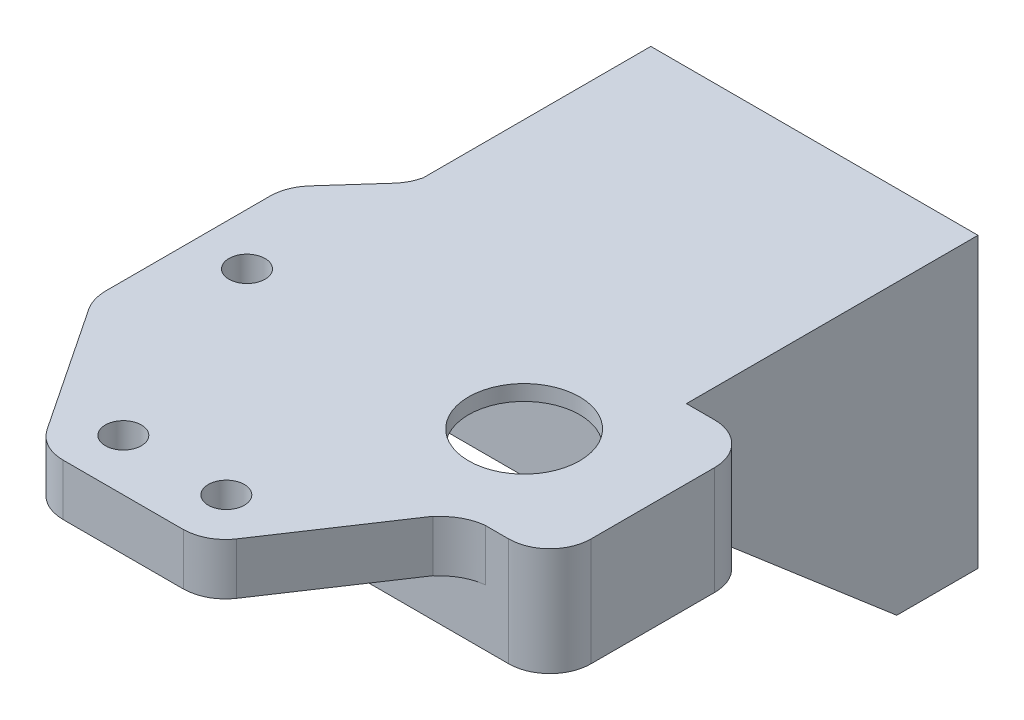
from build123d import *

# Parameters (mm, degrees)
CROQUIS2_W              = 35
CROQUIS2_H              = 20
SALIENTE_EXTRUIR1_DEPTH = 10.5
CROQUIS3_W              = 23
CROQUIS3_H              = 13
CORTAR_EXTRUIR1_DEPTH   = 9
CROQUIS4_R              = 1
CORTAR_EXTRUIR2_DEPTH   = 4
CROQUIS5_R              = 5.386
CORTAR_EXTRUIR3_DEPTH   = 4
REDONDEO1_R             = 4
SALIENTE_EXTRUIR2_DEPTH = 5
CROQUIS13_W             = 23
CROQUIS13_H             = 13
CORTAR_EXTRUIR4_DEPTH   = 9
CORTAR_EXTRUIR5_REACH   = 39.771
CROQUIS14_R             = 5.386
CORTAR_EXTRUIR6_REACH   = 40.156
CROQUIS15_R             = 1.75
CROQUIS17_W             = 28.298517207
CROQUIS17_H             = 28
SALIENTE_EXTRUIR5_DEPTH = 38.5
CROQUIS18_W             = 6.74314
CROQUIS18_H             = 28.298517207
CORTAR_EXTRUIR7_DEPTH   = 38.5
CROQUIS19_W             = 25.75686
CROQUIS19_H             = 20
CORTAR_EXTRUIR8_DEPTH   = 20.5
CORTAR_EXTRUIR9_DEPTH   = 3
CROQUIS21_R             = 2.49
CROQUIS21_R_2           = 1.3
CORTAR_EXTRUIR10_DEPTH  = 5
CORTAR_EXTRUIR11_DEPTH  = 32


with BuildPart() as part:
    # Croquis2 → Saliente-Extruir1 (new body)
    with BuildSketch(Plane(origin=(0, 0, 0), x_dir=(1, 0, 0), z_dir=(0, 1, 0))):
        with Locations((1.579773814, 6.543311496)):
            Rectangle(CROQUIS2_W, CROQUIS2_H)
    extrude(amount=SALIENTE_EXTRUIR1_DEPTH)

    # Croquis3 → Cortar-Extruir1 (cut)
    with BuildSketch(Plane.XZ):
        with Locations((1.579773814, -6.543311496)):
            Rectangle(CROQUIS3_W, CROQUIS3_H)
    extrude(amount=-CORTAR_EXTRUIR1_DEPTH, mode=Mode.SUBTRACT)

    # Croquis4 → Cortar-Extruir2 (cut)
    with BuildSketch(Plane.XZ):
        with Locations(Location((-12.220226186, -6.543311496, 0), (0, 0, 270))):
            Circle(CROQUIS4_R)
        with Locations(Location((15.379773814, -6.543311496, 0), (0, 0, 270))):
            Circle(CROQUIS4_R)
    extrude(amount=-CORTAR_EXTRUIR2_DEPTH, mode=Mode.SUBTRACT)

    # Croquis5 → Cortar-Extruir3 (cut)
    with BuildSketch(Plane.XZ.offset(-9)):
        with Locations(Location((6.579773814, -6.543311496, 0), (0, 0, 270))):
            Circle(CROQUIS5_R)
    extrude(amount=-CORTAR_EXTRUIR3_DEPTH, mode=Mode.SUBTRACT)

    # Redondeo1
    redondeo1_edges = [part.edges().sort_by_distance(p)[0] for p in [
        (-15.920226186, 5.25, -16.543311496),
        (19.079773814, 5.25, -16.543311496),
        (19.079773814, 5.25, 3.456688504),
        (-15.920226186, 5.25, 3.456688504),
    ]]
    fillet(redondeo1_edges, radius=REDONDEO1_R)

    # Croquis9 → Saliente-Extruir2 (add)
    with BuildSketch(Plane(origin=(0, 10.5, 0), x_dir=(1, 0, 0), z_dir=(0, 1, 0))):
        with BuildLine():
            Line((15.079773814, 16.543311496), (12.336633814, 16.543311496))
            add(Edge.make_bspline(
                [(12.336633814, 16.543311496), (10.698610232, 16.587808838), (9.508613814, 17.714311496)],
                knots=[0, 0, 0, 1, 1, 1], degree=2))
            Line((9.508613814, 17.714311496), (1.852613814, 25.371311496))
            add(Edge.make_bspline(
                [(1.852613814, 25.371311496), (0.662441449, 26.497382931), (-0.975386186, 26.543311496)],
                knots=[0, 0, 0, 1, 1, 1], degree=2))
            Line((-0.975386186, 26.543311496), (-19.318386186, 26.543311496))
            Line((-19.318386186, 26.543311496), (-19.318386186, 23.599311496))
            add(Edge.make_bspline(
                [(-19.318386186, 23.599311496), (-19.358098596, 22.086435901), (-20.338226186, 20.933311496)],
                knots=[0, 0, 0, 1, 1, 1], degree=2))
            Line((-20.338226186, 20.933311496), (-24.301226186, 16.502311496))
            add(Edge.make_bspline(
                [(-24.301226186, 16.502311496), (-25.282063001, 15.348930114), (-25.320226186, 13.835311496)],
                knots=[0, 0, 0, 1, 1, 1], degree=2))
            Line((-25.320226186, 13.835311496), (-25.320226186, -2.244688504))
            add(Edge.make_bspline(
                [(-25.320226186, -2.244688504), (-25.287234994, -3.456650155), (-24.649226186, -4.462688504)],
                knots=[0, 0, 0, 1, 1, 1], degree=2))
            Line((-24.649226186, -4.462688504), (-16.509226186, -16.674688504))
            add(Edge.make_bspline(
                [(-16.509226186, -16.674688504), (-15.292510612, -18.399803974), (-13.182226186, -18.456688504)],
                knots=[0, 0, 0, 1, 1, 1], degree=2))
            Line((-13.182226186, -18.456688504), (-1.464226186, -18.456688504))
            add(Edge.make_bspline(
                [(-1.464226186, -18.456688504), (0.665129481, -18.357989688), (1.862773814, -16.674688504)],
                knots=[0, 0, 0, 1, 1, 1], degree=2))
            Line((1.862773814, -16.674688504), (9.492773814, -5.237688504))
            add(Edge.make_bspline(
                [(9.492773814, -5.237688504), (10.98314296, -3.636391936), (12.820773814, -3.456688504)],
                knots=[0, 0, 0, 0.39653843, 0.39653843, 0.39653843], degree=2))
            Line((12.820773814, -3.456688504), (15.079773814, -3.456688504))
            add(Edge.make_bspline(
                [(15.079773814, -3.456688504), (18.736628063, -3.113542754), (19.079773814, 0.543311496)],
                knots=[0, 0, 0, 1, 1, 1], degree=2))
            Line((19.079773814, 0.543311496), (19.079773814, 12.543311496))
            add(Edge.make_bspline(
                [(15.079773814, 16.543311496), (18.736628063, 16.200165745), (19.079773814, 12.543311496)],
                knots=[0, 0, 0, 1, 1, 1], degree=2))
        make_face()
    extrude(amount=-SALIENTE_EXTRUIR2_DEPTH)

    # Croquis13 → Cortar-Extruir4 (cut)
    with BuildSketch(Plane.XZ):
        with Locations((1.579773814, -6.543311496)):
            Rectangle(CROQUIS13_W, CROQUIS13_H)
    extrude(amount=-CORTAR_EXTRUIR4_DEPTH, mode=Mode.SUBTRACT)

    # Croquis14 → Cortar-Extruir5 (cut, up to next)
    with BuildSketch(Plane.XZ.offset(-9), mode=Mode.PRIVATE) as cortar_extruir5_sk1:
        with Locations(Location((6.579773814, -6.543311496, 0), (0, 0, 270))):
            Circle(CROQUIS14_R)
    cortar_extruir5_tool1 = extrude(cortar_extruir5_sk1.sketch, amount=-CORTAR_EXTRUIR5_REACH, mode=Mode.PRIVATE) & part.part
    add(cortar_extruir5_tool1.solids().sort_by_distance((6.579774, 9, -6.543311))[0], mode=Mode.SUBTRACT)

    # Croquis15 → Cortar-Extruir6 (cut, up to next)
    with BuildSketch(Plane(origin=(0, 10.5, 0), x_dir=(1, 0, 0), z_dir=(0, 1, 0)), mode=Mode.PRIVATE) as cortar_extruir6_sk1:
        with Locations(Location((-20.320226186, 6.544311496, 0), (0, 0, 270))):
            Circle(CROQUIS15_R)
    cortar_extruir6_tool1 = extrude(cortar_extruir6_sk1.sketch, amount=-CORTAR_EXTRUIR6_REACH, mode=Mode.PRIVATE) & part.part
    # Croquis15 → Cortar-Extruir6 (cut, up to next)
    with BuildSketch(Plane(origin=(0, 10.5, 0), x_dir=(1, 0, 0), z_dir=(0, 1, 0)), mode=Mode.PRIVATE) as cortar_extruir6_sk2:
        with Locations(Location((-12.324304765, -13.453196841, 0), (0, 0, 270))):
            Circle(CROQUIS15_R)
    cortar_extruir6_tool2 = extrude(cortar_extruir6_sk2.sketch, amount=-CORTAR_EXTRUIR6_REACH, mode=Mode.PRIVATE) & part.part
    # Croquis15 → Cortar-Extruir6 (cut, up to next)
    with BuildSketch(Plane(origin=(0, 10.5, 0), x_dir=(1, 0, 0), z_dir=(0, 1, 0)), mode=Mode.PRIVATE) as cortar_extruir6_sk3:
        with Locations(Location((-2.324305375, -13.456688504, 0), (0, 0, 270))):
            Circle(CROQUIS15_R)
    cortar_extruir6_tool3 = extrude(cortar_extruir6_sk3.sketch, amount=-CORTAR_EXTRUIR6_REACH, mode=Mode.PRIVATE) & part.part
    add(cortar_extruir6_tool1.solids().sort_by_distance((-20.320226, 10.5, -6.544311))[0], mode=Mode.SUBTRACT)
    add(cortar_extruir6_tool2.solids().sort_by_distance((-12.324305, 10.5, 13.453197))[0], mode=Mode.SUBTRACT)
    add(cortar_extruir6_tool3.solids().sort_by_distance((-2.324305, 10.5, 13.456689))[0], mode=Mode.SUBTRACT)

    # Croquis17 → Saliente-Extruir5 (add)
    with BuildSketch(Plane(origin=(19.079773814, 0, 0), x_dir=(0, 0, -1), z_dir=(1, 0, 0))):
        with Locations((30.6925701, -3.5)):
            Rectangle(CROQUIS17_W, CROQUIS17_H)
    extrude(amount=-SALIENTE_EXTRUIR5_DEPTH)

    # Croquis18 → Cortar-Extruir7 (cut)
    with BuildSketch(Plane(origin=(0, 10.5, 0), x_dir=(1, 0, 0), z_dir=(0, 1, 0))):
        with Locations((15.708203814, 30.6925701)):
            Rectangle(CROQUIS18_W, CROQUIS18_H)
    extrude(amount=-CORTAR_EXTRUIR7_DEPTH, mode=Mode.SUBTRACT)

    # Croquis19 → Cortar-Extruir8 (cut)
    with BuildSketch(Plane.XY.offset(-16.543311496)):
        with Locations((-3.541796186, -7.5)):
            Rectangle(CROQUIS19_W, CROQUIS19_H)
    extrude(amount=-CORTAR_EXTRUIR8_DEPTH, mode=Mode.SUBTRACT)

    # Croquis20 → Cortar-Extruir9 (cut)
    with BuildSketch(Plane.XY.offset(-37.043311496)):
        with BuildLine():
            Line((-7.041796186, -2.5), (-0.041796186, -2.5))
            ThreePointArc((-0.041796186, -2.5), (3.458203814, -6), (-0.041796186, -9.5))
            Line((-0.041796186, -9.5), (-7.041796186, -9.5))
            ThreePointArc((-7.041796186, -9.5), (-10.541796186, -6), (-7.041796186, -2.5))
        make_face()
    extrude(amount=-CORTAR_EXTRUIR9_DEPTH, mode=Mode.SUBTRACT)

    # Croquis21 → Cortar-Extruir10 (cut)
    with BuildSketch(Plane.XY.offset(-40.043311496)):
        with Locations((-3.541796186, -6)):
            Circle(CROQUIS21_R)
        with Locations((-8.041796186, -6)):
            Circle(CROQUIS21_R_2)
        with Locations((0.958203814, -6)):
            Circle(CROQUIS21_R_2)
    extrude(amount=-CORTAR_EXTRUIR10_DEPTH, mode=Mode.SUBTRACT)

    # Croquis22 → Cortar-Extruir11 (cut)
    with BuildSketch(Plane(origin=(12.336633814, 0, 0), x_dir=(0, 0, -1), z_dir=(1, 0, 0))):
        Polygon((16.543311496, 0), (36.954350191, -17.5), (16.543311496, -17.5), align=None)
    extrude(amount=-CORTAR_EXTRUIR11_DEPTH, mode=Mode.SUBTRACT)


solid = part.part
